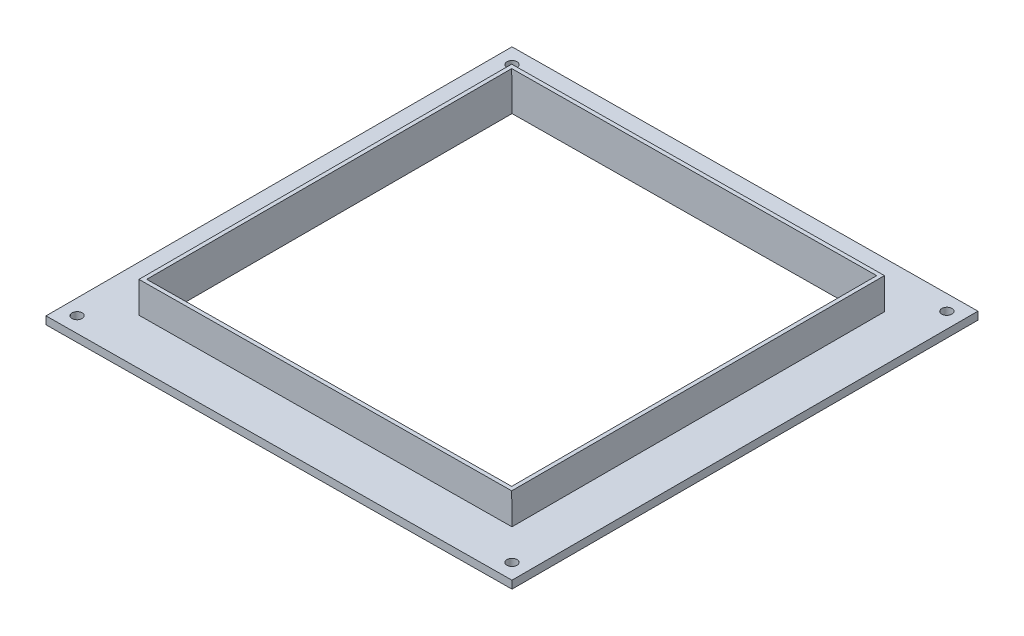
from build123d import *

# Parameters (mm, degrees)
BOSS_EXTRUDE1_DEPTH   = 5
SKETCH4_W             = 240
SKETCH4_H             = 240
SKETCH4_W_2           = 230.5
SKETCH4_H_2           = 230.5
BOSS_EXTRUDE2_DEPTH   = 20
SKETCH6_R             = 3.25
CUT_EXTRUDE1_DEPTH    = 20
SKETCH7_W             = 240
SKETCH7_H             = 240
CUT_EXTRUDE2_DEPTH    = 20
SKETCH8_W             = 240
SKETCH8_H             = 240
SKETCH8_W_2           = 235
SKETCH8_H_2           = 235
BOSS_EXTRUDE3_DEPTH   = 20
SKETCH9_W             = 235
SKETCH9_H             = 235
CUT_EXTRUDE3_DEPTH    = 20
BODY_MOVE_COPY1_ANGLE = 89.5
BODY_MOVE_COPY2_ANGLE = 90


with BuildPart() as part:
    # Sketch3 → Boss-Extrude1 (new body)
    with BuildSketch(Plane(origin=(0, 0, 0), x_dir=(1, 0, 0), z_dir=(0, 1, 0))):
        Polygon((300, 300), (150, 150), (300, 0), align=None)
        Polygon((150, 150), (0, 0), (300, 0), align=None)
        Polygon((0, 300), (0, 0), (150, 150), align=None)
        Polygon((0, 300), (150, 150), (300, 300), align=None)
    extrude(amount=BOSS_EXTRUDE1_DEPTH)

    # Sketch4 → Boss-Extrude2 (add)
    with BuildSketch(Plane(origin=(0, 5, 0), x_dir=(1, 0, 0), z_dir=(0, 1, 0))):
        with Locations((150, 150)):
            Rectangle(SKETCH4_W, SKETCH4_H)
        with Locations((150, 150)):
            Rectangle(SKETCH4_W_2, SKETCH4_H_2, mode=Mode.SUBTRACT)
    extrude(amount=BOSS_EXTRUDE2_DEPTH)

    # Sketch6 → Cut-Extrude1 (cut)
    with BuildSketch(Plane(origin=(0, 5, 0), x_dir=(1, 0, 0), z_dir=(0, 1, 0))):
        with Locations(Location((10, 10, 0), (0, 0, 270))):
            Circle(SKETCH6_R)
        with Locations(Location((290, 10, 0), (0, 0, 270))):
            Circle(SKETCH6_R)
        with Locations(Location((290, 290, 0), (0, 0, 270))):
            Circle(SKETCH6_R)
        with Locations(Location((10, 290, 0), (0, 0, 270))):
            Circle(SKETCH6_R)
    extrude(amount=-CUT_EXTRUDE1_DEPTH, mode=Mode.SUBTRACT)

    # Sketch7 → Cut-Extrude2 (cut)
    with BuildSketch(Plane(origin=(0, 25, 0), x_dir=(1, 0, 0), z_dir=(0, 1, 0))):
        with Locations((150, 150)):
            Rectangle(SKETCH7_W, SKETCH7_H)
    extrude(amount=-CUT_EXTRUDE2_DEPTH, mode=Mode.SUBTRACT)

    # Sketch8 → Boss-Extrude3 (add)
    with BuildSketch(Plane(origin=(0, 5, 0), x_dir=(1, 0, 0), z_dir=(0, 1, 0))):
        with Locations((150, 150)):
            Rectangle(SKETCH8_W, SKETCH8_H)
        with Locations((150, 150)):
            Rectangle(SKETCH8_W_2, SKETCH8_H_2, mode=Mode.SUBTRACT)
    extrude(amount=BOSS_EXTRUDE3_DEPTH)

    # Sketch9 → Cut-Extrude3 (cut)
    with BuildSketch(Plane(origin=(0, 5, 0), x_dir=(1, 0, 0), z_dir=(0, 1, 0))):
        with Locations((150, 150)):
            Rectangle(SKETCH9_W, SKETCH9_H)
    extrude(amount=-CUT_EXTRUDE3_DEPTH, mode=Mode.SUBTRACT)


with BuildPart() as part_1:
    # Body-Move/Copy1: moved
    add(part.part.rotate(Axis((150, 12.5, 0), (0, 0, -1)), BODY_MOVE_COPY1_ANGLE))


with BuildPart() as part_2:
    # Body-Move/Copy2: moved
    add(part_1.part.rotate(Axis((149.869101968, 12.412734645, 0), (0, 0, 1)), BODY_MOVE_COPY2_ANGLE))


solid = part_2.part
